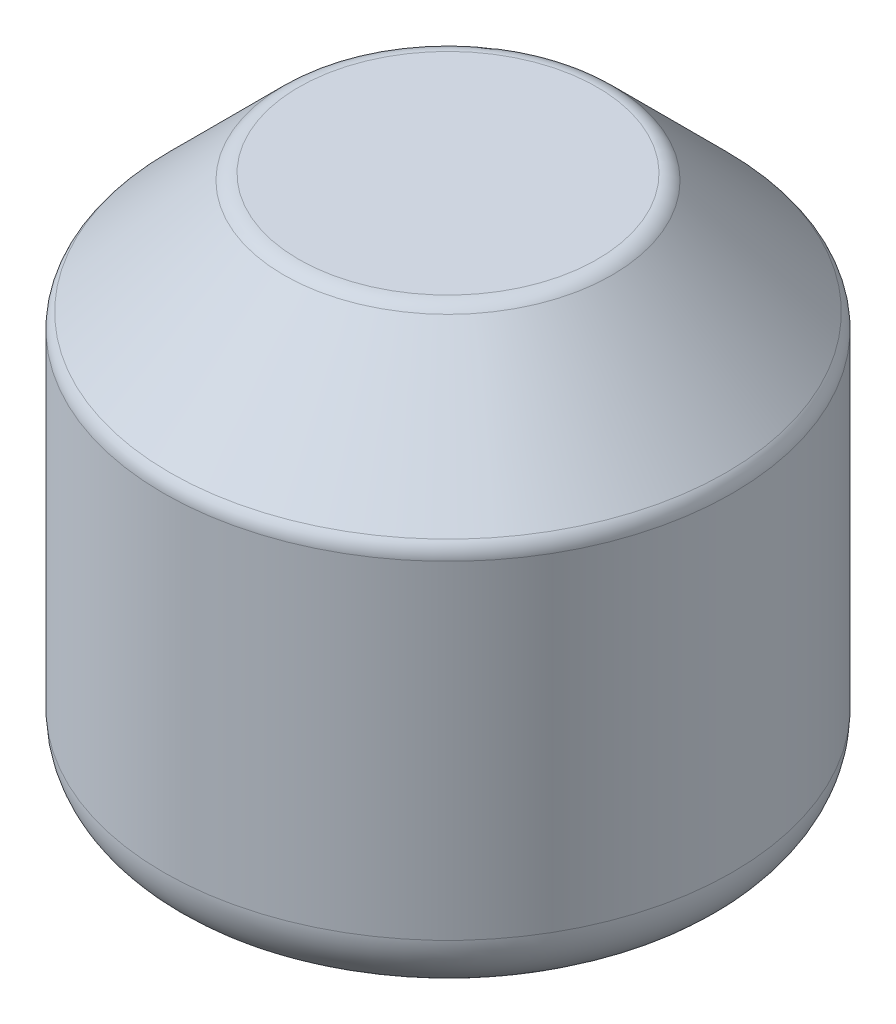
from build123d import *

# Parameters (mm, degrees)
SKETCH1_R           = 13.5
BOSS_EXTRUDE1_DEPTH = 25
CHAMFER1_SIZE       = 6
FILLET1_R           = 3
FILLET2_R           = 1


with BuildPart() as part:
    # Sketch1 → Boss-Extrude1 (new body)
    with BuildSketch(Plane(origin=(0, 0, 0), x_dir=(1, 0, 0), z_dir=(0, 1, 0))):
        with Locations(Location((0, 0, 0), (0, 0, 270))):
            Circle(SKETCH1_R)
    extrude(amount=BOSS_EXTRUDE1_DEPTH)

    # Chamfer1
    chamfer1_edges = [part.edges().sort_by_distance(p)[0] for p in [
        (0, 25, -13.5),
    ]]
    chamfer(chamfer1_edges, length=CHAMFER1_SIZE)

    # Fillet1
    fillet1_edges = [part.edges().sort_by_distance(p)[0] for p in [
        (0, 0, -13.5),
    ]]
    fillet(fillet1_edges, radius=FILLET1_R)

    # Fillet2
    fillet2_edges = [part.edges().sort_by_distance(p)[0] for p in [
        (0, 25, -7.5),
        (0, 19, -13.5),
    ]]
    fillet(fillet2_edges, radius=FILLET2_R)


solid = part.part
